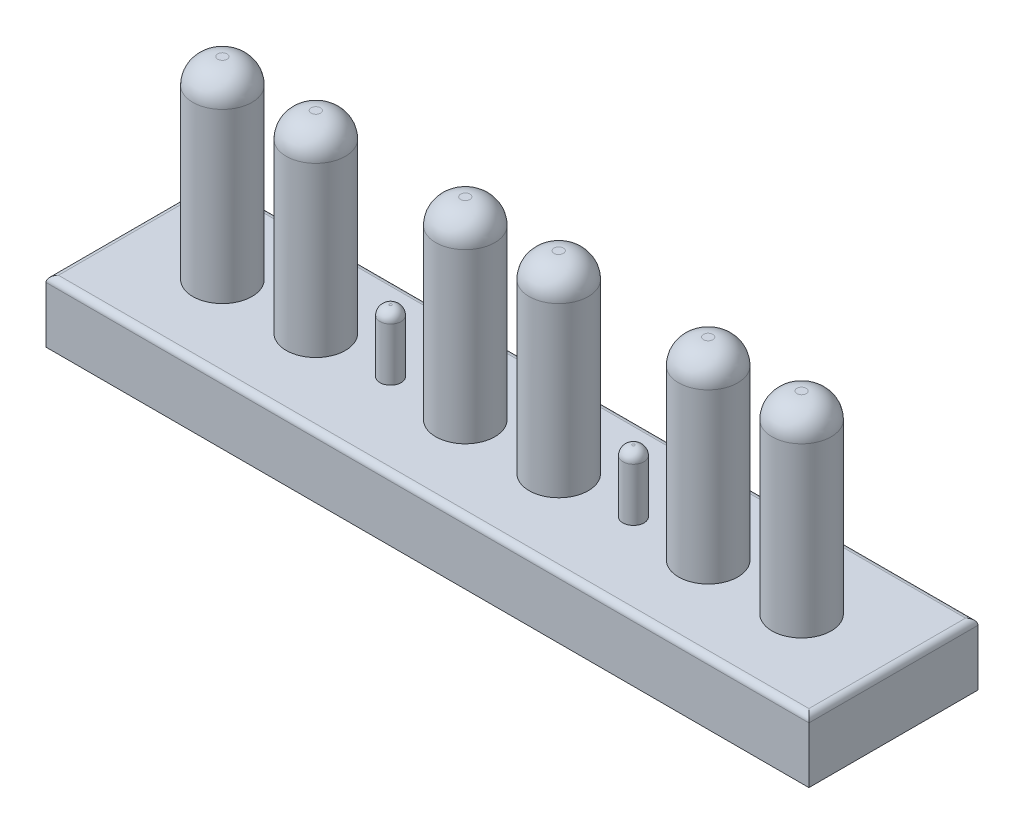
from build123d import *

# Parameters (mm, degrees)
ESQUISSE2_R          = 9.5
BOSS_EXTRU_1_DEPTH   = 62
BOSS_EXTRU_1_2_DEPTH = 62
BOSS_EXTRU_1_3_DEPTH = 62
BOSS_EXTRU_1_4_DEPTH = 62
BOSS_EXTRU_1_5_DEPTH = 62
BOSS_EXTRU_1_6_DEPTH = 62
ESQUISSE2_4_R        = 9.5
ESQUISSE2_4_R_2      = 3.4
BOSS_EXTRU_2_DEPTH   = 20
CONG_3_R             = 8
CONG_4_R             = 8
CONG_5_R             = 8
CONG_6_R             = 8
CONG_7_R             = 8
CONG_8_R             = 8
CONG_10_R            = 3
CONG_11_R            = 3
ESQUISSE4_W          = 245
ESQUISSE4_H          = 54.293120758
BOSS_EXTRU_3_DEPTH   = 20
CONG_12_R            = 2


with BuildPart() as part:
    # Esquisse2 → Boss.-Extru.1 (new body)
    with BuildSketch(Plane(origin=(0, 0, 0), x_dir=(1, 0, 0), z_dir=(0, 1, 0))):
        with Locations((32.457497884, 0)):
            Circle(ESQUISSE2_R)
    extrude(amount=BOSS_EXTRU_1_DEPTH)



with BuildPart() as body_2:
    # Esquisse2 → Boss.-Extru.1 2 (new body)
    with BuildSketch(Plane(origin=(0, 0, 0), x_dir=(1, 0, 0), z_dir=(0, 1, 0))):
        with Locations((62.457497884, 0)):
            Circle(ESQUISSE2_R)
    extrude(amount=BOSS_EXTRU_1_2_DEPTH)


with BuildPart() as body_3:
    # Esquisse2 → Boss.-Extru.1 3 (new body)
    with BuildSketch(Plane(origin=(0, 0, 0), x_dir=(1, 0, 0), z_dir=(0, 1, 0))):
        with Locations((-123.542502116, 0)):
            Circle(ESQUISSE2_R)
    extrude(amount=BOSS_EXTRU_1_3_DEPTH)


with BuildPart() as body_4:
    # Esquisse2 → Boss.-Extru.1 4 (new body)
    with BuildSketch(Plane(origin=(0, 0, 0), x_dir=(1, 0, 0), z_dir=(0, 1, 0))):
        with Locations((-93.542502116, 0)):
            Circle(ESQUISSE2_R)
    extrude(amount=BOSS_EXTRU_1_4_DEPTH)


with BuildPart() as body_5:
    # Esquisse2 → Boss.-Extru.1 5 (new body)
    with BuildSketch(Plane(origin=(0, 0, 0), x_dir=(1, 0, 0), z_dir=(0, 1, 0))):
        with Locations((-45.542502116, 0)):
            Circle(ESQUISSE2_R)
    extrude(amount=BOSS_EXTRU_1_5_DEPTH)


with BuildPart() as body_6:
    # Esquisse2 → Boss.-Extru.1 6 (new body)
    with BuildSketch(Plane(origin=(0, 0, 0), x_dir=(1, 0, 0), z_dir=(0, 1, 0))):
        with Locations((-15.542502116, 0)):
            Circle(ESQUISSE2_R)
    extrude(amount=BOSS_EXTRU_1_6_DEPTH)


with BuildPart() as part_1:
    add(part.part)

    add(body_2.part)  # Boss.-Extru.2 merges body 2

    add(body_3.part)  # Boss.-Extru.2 merges body 3

    add(body_4.part)  # Boss.-Extru.2 merges body 4

    add(body_5.part)  # Boss.-Extru.2 merges body 5

    add(body_6.part)  # Boss.-Extru.2 merges body 6
    # Esquisse2<4> → Boss.-Extru.2 (add)
    with BuildSketch(Plane(origin=(0, 0, 0), x_dir=(1, 0, 0), z_dir=(0, 1, 0))):
        with Locations((32.457497884, 0)):
            Circle(ESQUISSE2_4_R)
        with Locations((62.457497884, 0)):
            Circle(ESQUISSE2_4_R)
        with Locations((-123.542502116, 0)):
            Circle(ESQUISSE2_4_R)
        with Locations((-93.542502116, 0)):
            Circle(ESQUISSE2_4_R)
        with Locations((-45.542502116, 0)):
            Circle(ESQUISSE2_4_R)
        with Locations((-15.542502116, 0)):
            Circle(ESQUISSE2_4_R)
        with Locations((-69.542502116, 0)):
            Circle(ESQUISSE2_4_R_2)
        with Locations((8.457497884, 0)):
            Circle(ESQUISSE2_4_R_2)
    extrude(amount=BOSS_EXTRU_2_DEPTH)

    # Congé3
    cong_3_edges = [part_1.edges().sort_by_distance(p)[0] for p in [
        (-133.042502116, 62, 0),
    ]]
    fillet(cong_3_edges, radius=CONG_3_R)

    # Congé4
    cong_4_edges = [part_1.edges().sort_by_distance(p)[0] for p in [
        (-103.042502116, 62, 0),
    ]]
    fillet(cong_4_edges, radius=CONG_4_R)

    # Congé5
    cong_5_edges = [part_1.edges().sort_by_distance(p)[0] for p in [
        (-55.042502116, 62, 0),
    ]]
    fillet(cong_5_edges, radius=CONG_5_R)

    # Congé6
    cong_6_edges = [part_1.edges().sort_by_distance(p)[0] for p in [
        (-25.042502116, 62, 0),
    ]]
    fillet(cong_6_edges, radius=CONG_6_R)

    # Congé7
    cong_7_edges = [part_1.edges().sort_by_distance(p)[0] for p in [
        (22.957497884, 62, 0),
    ]]
    fillet(cong_7_edges, radius=CONG_7_R)

    # Congé8
    cong_8_edges = [part_1.edges().sort_by_distance(p)[0] for p in [
        (52.957497884, 62, 0),
    ]]
    fillet(cong_8_edges, radius=CONG_8_R)

    # Congé10
    cong_10_edges = [part_1.edges().sort_by_distance(p)[0] for p in [
        (-72.942502116, 20, 0),
    ]]
    fillet(cong_10_edges, radius=CONG_10_R)

    # Congé11
    cong_11_edges = [part_1.edges().sort_by_distance(p)[0] for p in [
        (5.057497884, 20, 0),
    ]]
    fillet(cong_11_edges, radius=CONG_11_R)

    # Esquisse4 → Boss.-Extru.3 (add)
    with BuildSketch(Plane(origin=(0, 0, 0), x_dir=(-1, 0, 0), z_dir=(0, -1, 0))):
        with Locations((30.542502116, 0)):
            Rectangle(ESQUISSE4_W, ESQUISSE4_H)
    extrude(amount=BOSS_EXTRU_3_DEPTH)

    # Congé12
    cong_12_edges = [part_1.edges().sort_by_distance(p)[0] for p in [
        (-153.042502116, 0, 0),
        (-30.542502116, 0, 27.146560379),
        (91.957497884, 0, 0),
        (-30.542502116, 0, -27.146560379),
    ]]
    fillet(cong_12_edges, radius=CONG_12_R)


solid = part_1.part
